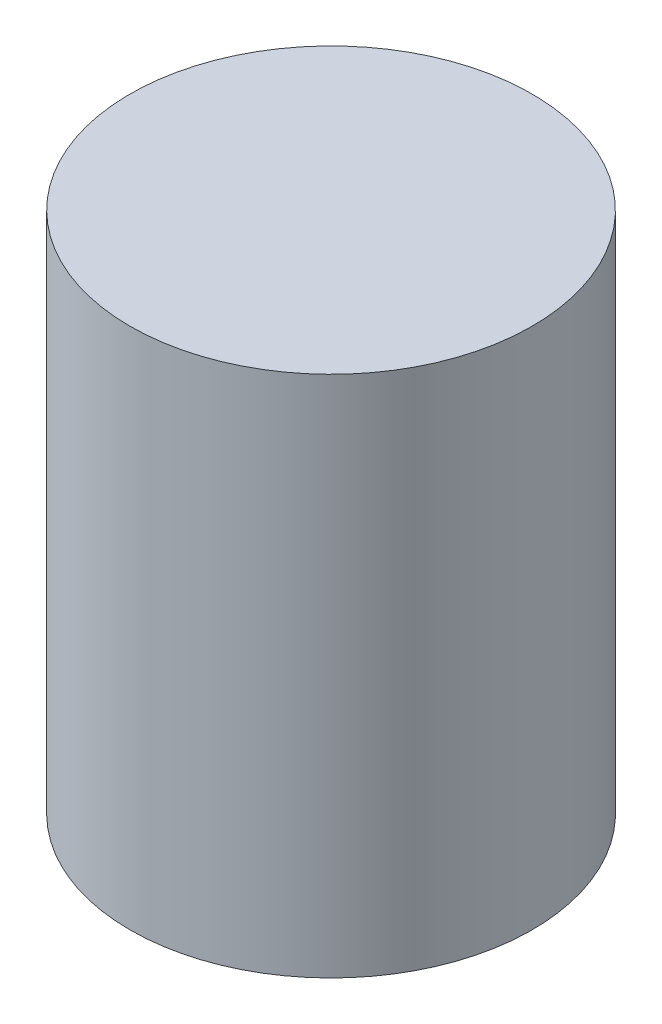
from build123d import *

# Parameters (mm, degrees)
SKETCH1_R           = 12.5
BOSS_EXTRUDE1_DEPTH = 32.5


with BuildPart() as part:
    # Sketch1 → Boss-Extrude1 (new body)
    with BuildSketch(Plane(origin=(0, 0, 0), x_dir=(1, 0, 0), z_dir=(0, 1, 0))):
        with Locations(Location((0, 0, 0), (0, 0, 270))):
            Circle(SKETCH1_R)
    extrude(amount=BOSS_EXTRUDE1_DEPTH)


solid = part.part
